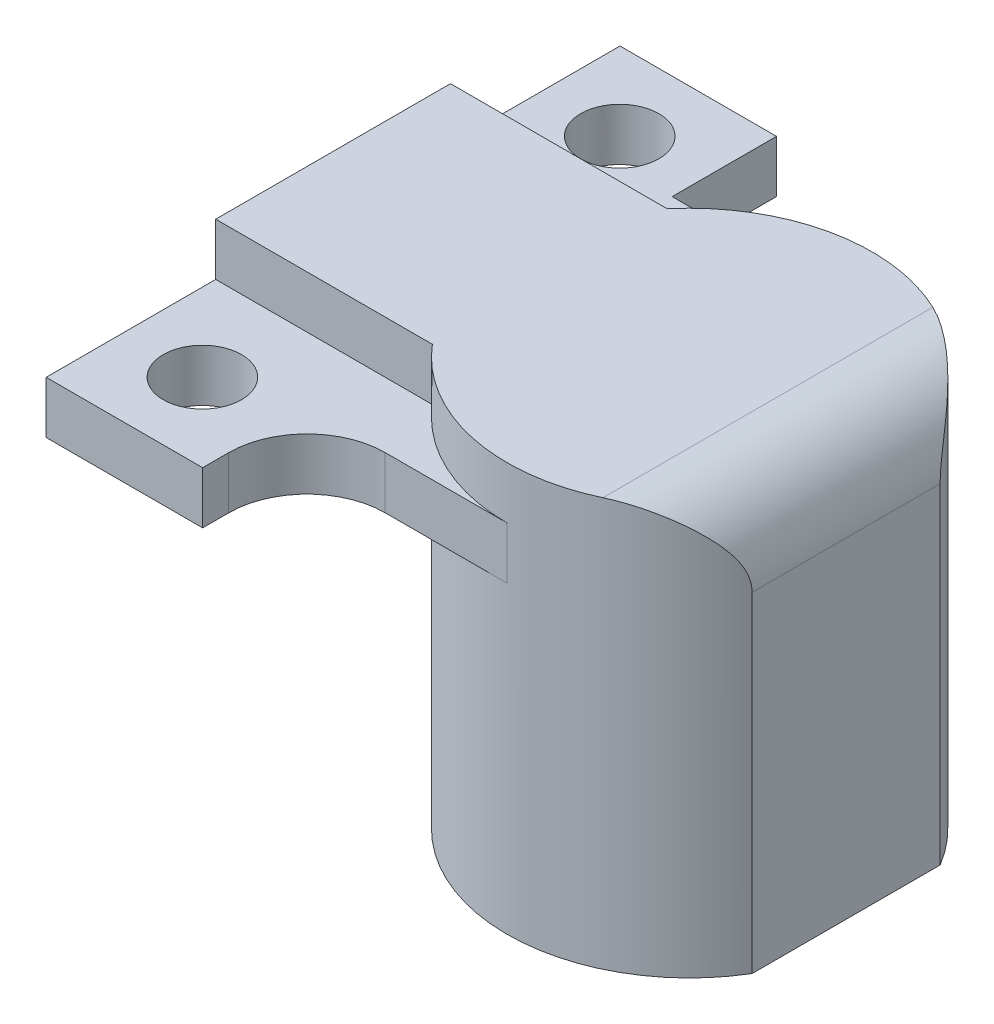
from build123d import *
from build123d.topology import SkipClean

# Parameters (mm, degrees)
SKETCH1_R           = 7
SKETCH1_R_2         = 5.2
BOSS_EXTRUDE1_DEPTH = 15.66
BOSS_EXTRUDE2_START = -4
SKETCH2_W           = 6
SKETCH2_H           = 4
BOSS_EXTRUDE2_DEPTH = 4
CUT_EXTRUDE2_START  = -2
SKETCH2_3_W         = 6
SKETCH2_3_H         = 4
CUT_EXTRUDE2_DEPTH  = 2
SKETCH4_R           = 1.5
CUT_EXTRUDE1_DEPTH  = 10
FILLET7_R           = 3
BOSS_EXTRUDE3_START = -1
SKETCH5_R           = 5.2
BOSS_EXTRUDE3_DEPTH = 1
CUT_EXTRUDE3_DEPTH  = 15.66
FILLET8_R           = 3
BOSS_EXTRUDE4_DEPTH = 2


with BuildPart() as part:
    # Sketch1 → Boss-Extrude1 (new body)
    with BuildSketch(Plane(origin=(0, 0, 0), x_dir=(1, 0, 0), z_dir=(0, 1, 0))):
        with Locations(Location((0, 0, 0), (0, 0, 270))):
            Circle(SKETCH1_R)
        with Locations(Location((0, 0, 0), (0, 0, 270))):
            Circle(SKETCH1_R_2, mode=Mode.SUBTRACT)
    extrude(amount=BOSS_EXTRUDE1_DEPTH)

    # Sketch2 → Boss-Extrude2 (add)
    with BuildSketch(Plane(origin=(0, 15.66, 0), x_dir=(1, 0, 0), z_dir=(0, 1, 0)).offset(BOSS_EXTRUDE2_START)):
        with Locations((-10.67, -9)):
            Rectangle(SKETCH2_W, SKETCH2_H)
        with BuildLine():
            ThreePointArc((0, -7), (-7, 0), (0, 7))
            Line((0, 7), (-7.67, 7))
            Line((-7.67, 7), (-13.67, 7))
            Line((-13.67, 7), (-13.67, -7))
            Line((-13.67, -7), (-7.67, -7))
            Line((-7.67, -7), (0, -7))
        make_face()
        with Locations((-10.67, 9)):
            Rectangle(SKETCH2_W, SKETCH2_H)
    extrude(amount=BOSS_EXTRUDE2_DEPTH)

    # Sketch2<3> → Cut-Extrude2 (cut)
    with SkipClean():  # the faces are left unmerged after this step: merging them gives an invalid solid
        with BuildSketch(Plane(origin=(0, 15.66, 0), x_dir=(1, 0, 0), z_dir=(0, 1, 0)).offset(CUT_EXTRUDE2_START)):
            with BuildLine():
                ThreePointArc((0, -7), (-7, 0), (0, 7))
                Line((0, 7), (-7.67, 7))
                Line((-7.67, 7), (-13.67, 7))
                Line((-13.67, 7), (-13.67, -7))
                Line((-13.67, -7), (-7.67, -7))
                Line((-7.67, -7), (0, -7))
            make_face()
            with Locations((-10.67, 9)):
                Rectangle(SKETCH2_3_W, SKETCH2_3_H)
            with Locations((-10.67, -9)):
                Rectangle(SKETCH2_3_W, SKETCH2_3_H)
        extrude(amount=CUT_EXTRUDE2_DEPTH, mode=Mode.SUBTRACT)

    # Sketch4 → Cut-Extrude1 (cut)
    with SkipClean():  # the faces are left unmerged after this step: merging them gives an invalid solid
        with BuildSketch(Plane.XZ.offset(-11.66)):
            with Locations(Location((-10.68, -8, 0), (0, 0, 270))):
                Circle(SKETCH4_R)
            with Locations(Location((-10.68, 8, 0), (0, 0, 270))):
                Circle(SKETCH4_R)
        extrude(amount=-CUT_EXTRUDE1_DEPTH, mode=Mode.SUBTRACT)

    # Fillet7
    fillet7_edges = [part.edges().sort_by_distance(p)[0] for p in [
        (-7.67, 12.66, 7),
    ]]
    fillet(fillet7_edges, radius=FILLET7_R)

    # Sketch5 → Boss-Extrude3 (add)
    with SkipClean():  # the faces are left unmerged after this step: merging them gives an invalid solid
        with BuildSketch(Plane(origin=(0, 15.66, 0), x_dir=(1, 0, 0), z_dir=(0, 1, 0)).offset(BOSS_EXTRUDE3_START)):
            with Locations(Location((0, 0, 0), (0, 0, 270))):
                Circle(SKETCH5_R)
        extrude(amount=BOSS_EXTRUDE3_DEPTH)

    # Sketch6 → Cut-Extrude3 (cut)
    with BuildSketch(Plane.XZ):
        with BuildLine():
            Line((6, -3.605551275), (6, 3.605551275))
            ThreePointArc((6, 3.605551275), (7, 0), (6, -3.605551275))
        make_face()
    extrude(amount=-CUT_EXTRUDE3_DEPTH, mode=Mode.SUBTRACT)

    # Fillet8
    fillet8_edges = [part.edges().sort_by_distance(p)[0] for p in [
        (6, 15.66, 0),
    ]]
    fillet(fillet8_edges, radius=FILLET8_R)

    # Sketch7 → Boss-Extrude4 (add)
    with BuildSketch(Plane(origin=(0, 13.66, 0), x_dir=(1, 0, 0), z_dir=(0, 1, 0))):
        with BuildLine():
            Line((-13.67, 4.5), (-13.67, -4.5))
            Line((-13.67, -4.5), (-5.361902647, -4.5))
            ThreePointArc((-5.361902647, -4.5), (-7, 0), (-5.361902647, 4.5))
            Line((-5.361902647, 4.5), (-13.67, 4.5))
        make_face()
    extrude(amount=BOSS_EXTRUDE4_DEPTH)


solid = part.part
